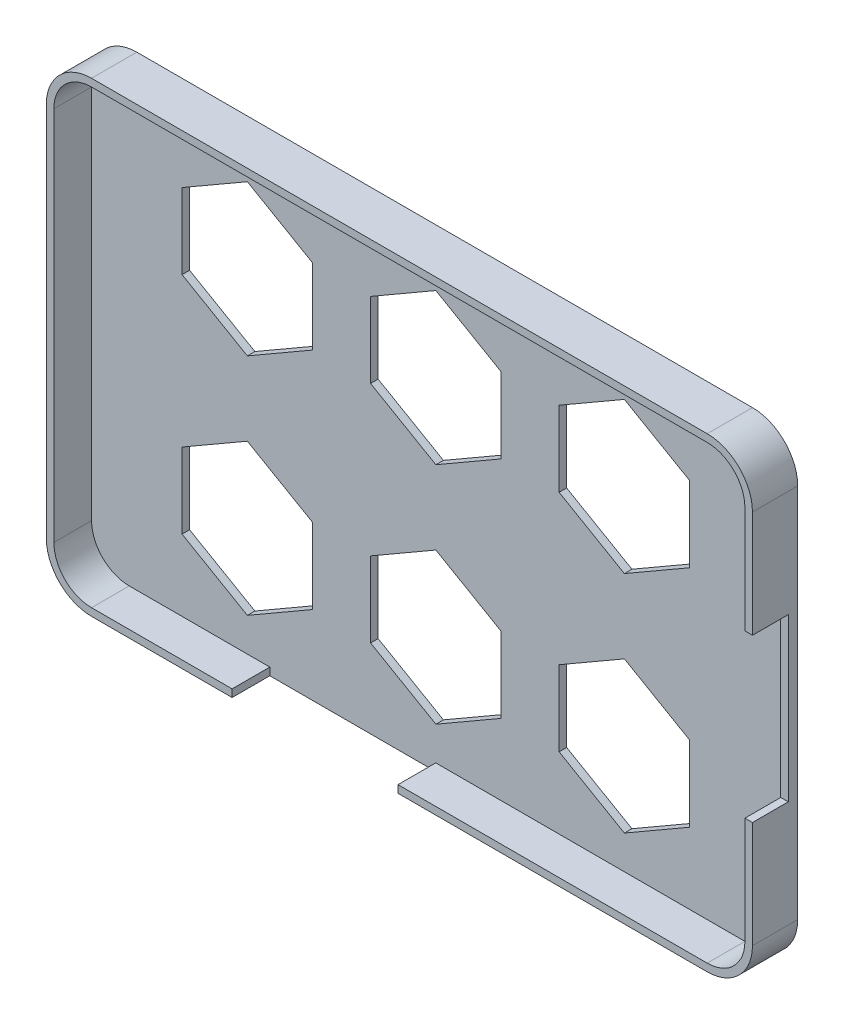
from build123d import *

# Parameters (mm, degrees)
SKIZZE1_W                       = 61.8
SKIZZE1_H                       = 93.64
AUFSATZ_LINEAR_AUSTRAGEN1_DEPTH = 6
VERRUNDUNG1_R                   = 6
WANDUNG1_T                      = -1
SKIZZE2_W                       = 21.5
SKIZZE2_H                       = 9.5
SCHNITT_LINEAR_AUSTRAGEN1_DEPTH = 6
SKIZZE3_W                       = 22
SKIZZE3_H                       = 5
SCHNITT_LINEAR_AUSTRAGEN2_DEPTH = 6
SCHNITT_LINEAR_AUSTRAGEN4_DEPTH = 6
LINEARES_MUSTER1_COUNT          = 3
LINEARES_MUSTER1_PITCH          = 25


with BuildPart() as part:
    # Skizze1 → Aufsatz-Linear austragen1 (new body)
    with BuildSketch(Plane(origin=(0, 0, 0), x_dir=(0, 1, 0), z_dir=(0, 0, 1))):
        Rectangle(SKIZZE1_W, SKIZZE1_H)
    extrude(amount=AUFSATZ_LINEAR_AUSTRAGEN1_DEPTH)

    # Verrundung1
    verrundung1_edges = [part.edges().sort_by_distance(p)[0] for p in [
        (46.82, 30.9, 3),
        (46.82, -30.9, 3),
        (-46.82, -30.9, 3),
        (-46.82, 30.9, 3),
    ]]
    fillet(verrundung1_edges, radius=VERRUNDUNG1_R)

    # Wandung1
    wandung1_openings = [part.faces().sort_by_distance(p)[0] for p in [
        (0, 0, 6),
    ]]
    offset(amount=WANDUNG1_T, openings=wandung1_openings, kind=Kind.INTERSECTION)

    # Skizze2 → Schnitt-Linear austragen1 (cut)
    with BuildSketch(Plane.YZ.offset(46.82)):
        with Locations((0, 6)):
            Rectangle(SKIZZE2_W, SKIZZE2_H)
    extrude(amount=-SCHNITT_LINEAR_AUSTRAGEN1_DEPTH, mode=Mode.SUBTRACT)

    # Skizze3 → Schnitt-Linear austragen2 (cut)
    with BuildSketch(Plane.XZ.offset(30.9)):
        with Locations((-11.18, 3.5)):
            Rectangle(SKIZZE3_W, SKIZZE3_H)
    extrude(amount=-SCHNITT_LINEAR_AUSTRAGEN2_DEPTH, mode=Mode.SUBTRACT)

    # Skizze4 → Schnitt-Linear austragen4 (cut)
    with BuildSketch(Plane(origin=(0, 0, 0), x_dir=(1, 0, 0), z_dir=(0, 0, -1))):
        Polygon((-25.159745962, 25.45), (-33.82, 20.45), (-33.82, 10.45), (-25.159745962, 5.45), (-16.499491924, 10.45), (-16.499491924, 20.45), align=None)
        Polygon((-25.159745962, -4.35), (-33.82, -9.35), (-33.82, -19.35), (-25.159745962, -24.35), (-16.499491924, -19.35), (-16.499491924, -9.35), align=None)
    schnitt_linear_austragen4 = extrude(amount=-SCHNITT_LINEAR_AUSTRAGEN4_DEPTH, mode=Mode.SUBTRACT)

    # Lineares Muster1: Schnitt-Linear austragen4 ×3
    with Locations(*[(i * LINEARES_MUSTER1_PITCH, 0, 0) for i in range(1, LINEARES_MUSTER1_COUNT)]):
        add(schnitt_linear_austragen4, mode=Mode.SUBTRACT)


solid = part.part
